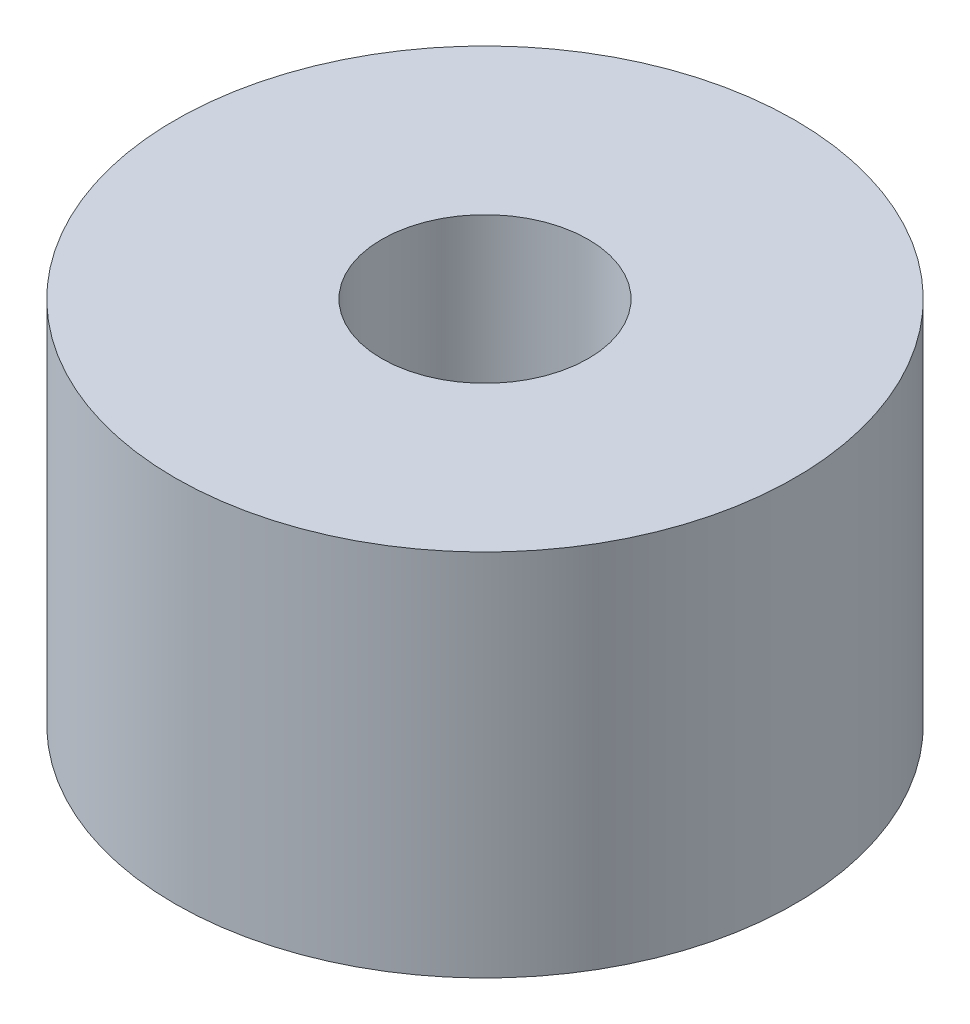
from build123d import *

# Parameters (mm, degrees)
REVOLVESKETCH_W = 14
REVOLVESKETCH_H = 25


with BuildPart() as part:
    # RevolveSketch → OrdinaryBossRevolve (revolve)
    with BuildSketch(Plane.XY, mode=Mode.PRIVATE) as ordinarybossrevolve_sk:
        with Locations((16, 4.5)):
            Rectangle(REVOLVESKETCH_W, REVOLVESKETCH_H)
    revolve(ordinarybossrevolve_sk.sketch.rotate(Axis((2, -13, 0), (0, 1, 0)), 90), axis=Axis((2, -13, 0), (0, 1, 0)))


solid = part.part
